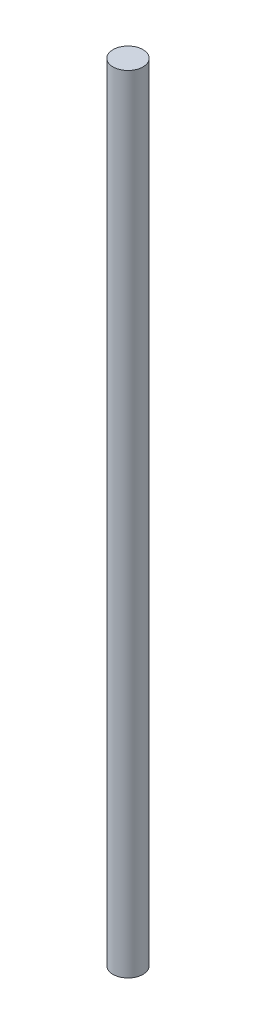
from build123d import *

# Parameters (mm, degrees)
SKETCH1_R           = 7.5
BOSS_EXTRUDE1_DEPTH = 393


with BuildPart() as part:
    # Sketch1 → Boss-Extrude1 (new body)
    with BuildSketch(Plane(origin=(0, 0, 0), x_dir=(1, 0, 0), z_dir=(0, 1, 0))):
        with Locations(Location((0, 0, 0), (0, 0, 270))):
            Circle(SKETCH1_R)
    extrude(amount=BOSS_EXTRUDE1_DEPTH)


solid = part.part
